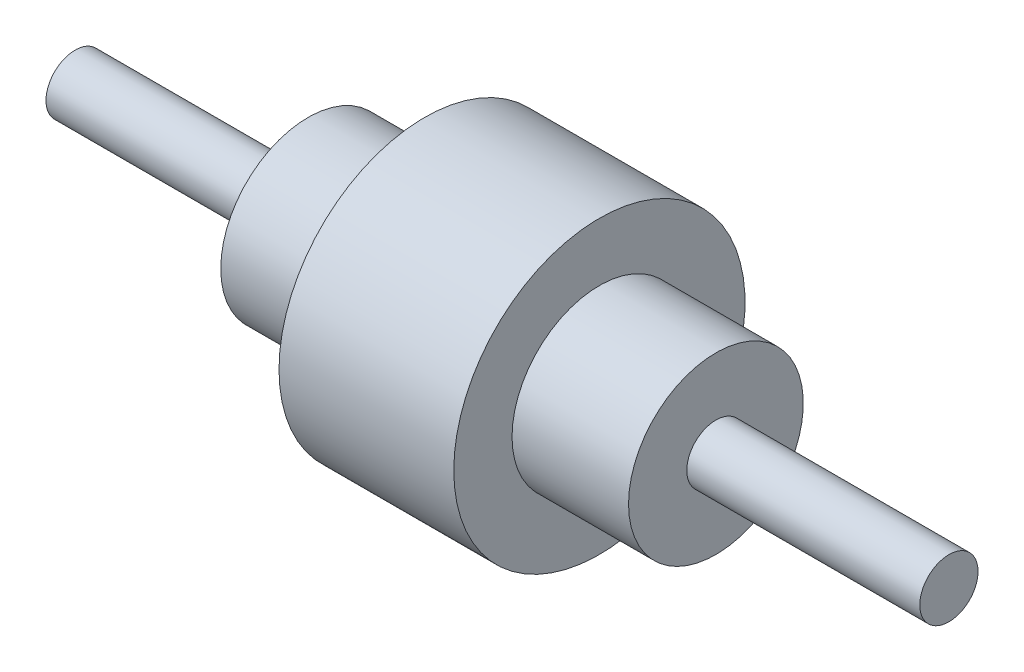
from build123d import *

# Parameters (mm, degrees)
SKETCH_1_W = 80
SKETCH_1_H = 10


with BuildPart() as part:
    # 草圖1 → 旋轉1 (revolve)
    with BuildSketch(Plane.XY, mode=Mode.PRIVATE) as revolve_1_sk:
        Polygon((180, 30), (180, 0), (220, 0), (220, 10), (220, 30), align=None)
        with Locations((260, 5)):
            Rectangle(SKETCH_1_W, SKETCH_1_H)
        Polygon((120, 30), (120, 0), (180, 0), (180, 30), (180, 50), (120, 50), align=None)
        Polygon((80, 10), (80, 0), (120, 0), (120, 30), (80, 30), align=None)
        with Locations((40, 5)):
            Rectangle(SKETCH_1_W, SKETCH_1_H)
    revolve(revolve_1_sk.sketch.rotate(Axis((0, 0, 0), (1, 0, 0)), 90), axis=Axis((0, 0, 0), (1, 0, 0)))


solid = part.part
